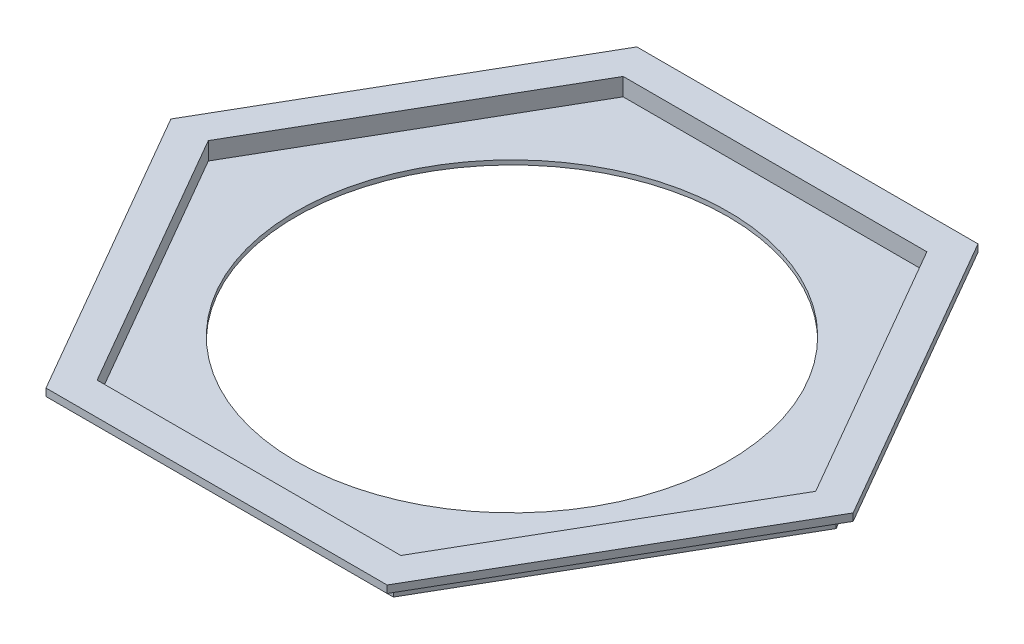
from build123d import *

# Parameters (mm, degrees)
BOSS_EXTRUDE1_DEPTH = 25
BOSS_EXTRUDE2_DEPTH = 50
CUT_EXTRUDE1_DEPTH  = 60
CUT_EXTRUDE2_REACH  = 1534.714
SKETCH5_R           = 733.663605778


with BuildPart() as part:
    # Sketch1 → Boss-Extrude1 (new body)
    with BuildSketch(Plane(origin=(0, 0, 0), x_dir=(1, 0, 0), z_dir=(0, 1, 0))):
        Polygon((-578.86751, 1002.627938171), (-1157.73502, 0), (-578.86751, -1002.627938171), (578.86751, -1002.627938171), (1157.73502, 0), (578.86751, 1002.627938171), align=None)
    extrude(amount=-BOSS_EXTRUDE1_DEPTH)

    # Sketch3 → Boss-Extrude2 (add)
    with BuildSketch(Plane.XZ.offset(25)):
        Polygon((-549.999996541, -952.627938171), (549.999996541, -952.627938171), (1099.999993081, 0), (549.999996541, 952.627938171), (-549.999996541, 952.627938171), (-1099.999993081, 0), align=None)
    extrude(amount=BOSS_EXTRUDE2_DEPTH)

    # Sketch4 → Cut-Extrude1 (cut)
    with BuildSketch(Plane(origin=(0, 0, 0), x_dir=(1, 0, 0), z_dir=(0, 1, 0))):
        Polygon((515.358980389, 892.627938171), (-515.358980389, 892.627938171), (-1030.717960778, 0), (-515.358980389, -892.627938171), (515.358980389, -892.627938171), (1030.717960778, 0), align=None)
    extrude(amount=-CUT_EXTRUDE1_DEPTH, mode=Mode.SUBTRACT)

    # Sketch5 → Cut-Extrude2 (cut, up to next)
    with BuildSketch(Plane(origin=(0, -60, 0), x_dir=(1, 0, 0), z_dir=(0, 1, 0)), mode=Mode.PRIVATE) as cut_extrude2_sk1:
        with Locations(Location((0, 0, 0), (0, 0, 270))):
            Circle(SKETCH5_R)
    cut_extrude2_tool1 = extrude(cut_extrude2_sk1.sketch, amount=-CUT_EXTRUDE2_REACH, mode=Mode.PRIVATE) & part.part
    add(cut_extrude2_tool1.solids().sort_by_distance((0, -60, 0))[0], mode=Mode.SUBTRACT)


solid = part.part
